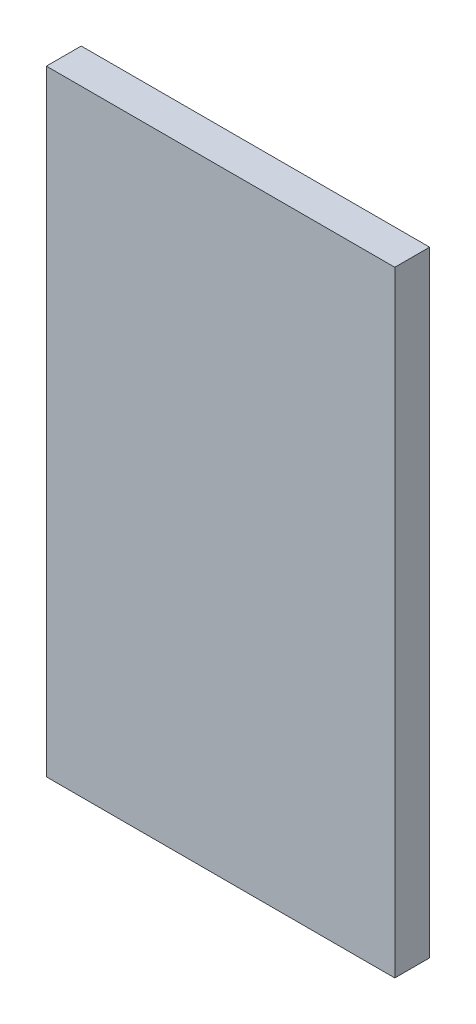
from build123d import *

# Parameters (mm, degrees)
SKETCH1_W           = 300
SKETCH1_H           = 530
BOSS_EXTRUDE1_DEPTH = 30


with BuildPart() as part:
    # Sketch1 → Boss-Extrude1 (new body)
    with BuildSketch(Plane.XY):
        Rectangle(SKETCH1_W, SKETCH1_H)
    extrude(amount=BOSS_EXTRUDE1_DEPTH)


solid = part.part
